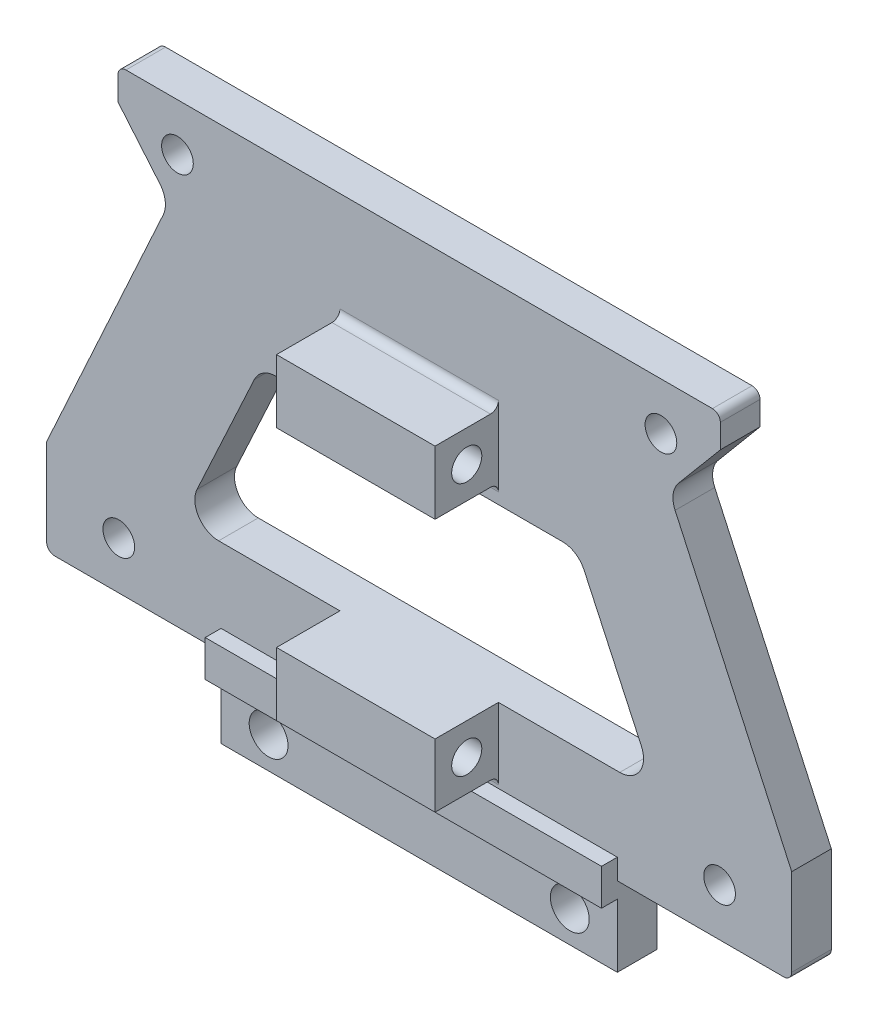
from build123d import *

# Parameters (mm, degrees)
SKETCH_1_R          = 2
EXTRUDE_2_DEPTH     = 5
SKETCH_3_W          = 20
SKETCH_3_H          = 8
EXTRUDE_3_DEPTH     = 8
SKETCH_4_R          = 1.9
CUT_EXTRUDE_1_DEPTH = 73.711050963
FILLET_1_R          = 3
FILLET_2_R          = 3
SKETCH_5_W          = 25
SKETCH_5_H          = 10
EXTRUDE_4_DEPTH     = 5
SKETCH_6_W          = 50
SKETCH_6_H          = 4.584747815
EXTRUDE_5_DEPTH     = 2
FILLET_3_R          = 1
FILLET_4_R          = 1
SKETCH_7_R          = 2.45
CUT_EXTRUDE_2_DEPTH = 4
FILLET_5_R          = 1
FILLET_6_R          = 1


with BuildPart() as part:
    # ｽｹｯﾁ1 → ﾎﾞｽ - 押し出し2 (new body)
    with BuildSketch(Plane.XY):
        Polygon((-47, -31.230740592), (-47, -43.230740592), (47, -43.230740592), (47, -31.230740592), (31.5, 2.619259408), (38, 10.369259408), (38, 14.369259408), (-38, 14.369259408), (-38, 10.369259408), (-31.5, 2.619259408), align=None)
        with Locations((-30.5, 8.369259408)):
            Circle(SKETCH_1_R, mode=Mode.SUBTRACT)
        with Locations((30.5, 8.369259408)):
            Circle(SKETCH_1_R, mode=Mode.SUBTRACT)
        with Locations((-37.9, -37.230740592)):
            Circle(SKETCH_1_R, mode=Mode.SUBTRACT)
        with Locations((37.9, -37.230740592)):
            Circle(SKETCH_1_R, mode=Mode.SUBTRACT)
        Polygon((-20, -9.630740592), (-30, -31.230740592), (30, -31.230740592), (20, -9.630740592), align=None, mode=Mode.SUBTRACT)
    extrude(amount=EXTRUDE_2_DEPTH)

    # ｽｹｯﾁ3 → ﾎﾞｽ - 押し出し3 (add)
    with BuildSketch(Plane.XY.offset(5)):
        with Locations((0, -3.230740592)):
            Rectangle(SKETCH_3_W, SKETCH_3_H)
        with Locations((0, -35.230740592)):
            Rectangle(SKETCH_3_W, SKETCH_3_H)
    extrude(amount=EXTRUDE_3_DEPTH)

    # ｽｹｯﾁ4 → ｶｯﾄ - 押し出し1 (cut, through all)
    with BuildSketch(Plane(origin=(10, 0, 0), x_dir=(0, 0, -1), z_dir=(1, 0, 0))):
        with Locations(Location((-9, -3.230740592, 0), (0, 0, 90))):
            Circle(SKETCH_4_R)
        with Locations(Location((-9, -35.230740592, 0), (0, 0, 90))):
            Circle(SKETCH_4_R)
    extrude(amount=-CUT_EXTRUDE_1_DEPTH, mode=Mode.SUBTRACT)

    # ﾌｨﾚｯﾄ1
    fillet_1_edges = [part.edges().sort_by_distance(p)[0] for p in [
        (-30, -31.230740592, 2.5),
        (30, -31.230740592, 2.5),
        (20, -9.630740592, 2.5),
        (-20, -9.630740592, 2.5),
    ]]
    fillet(fillet_1_edges, radius=FILLET_1_R)

    # ﾌｨﾚｯﾄ2
    fillet_2_edges = [part.edges().sort_by_distance(p)[0] for p in [
        (-31.5, 2.619259408, 2.5),
        (31.5, 2.619259408, 2.5),
    ]]
    fillet(fillet_2_edges, radius=FILLET_2_R)

    # ｽｹｯﾁ5 → ﾎﾞｽ - 押し出し4 (add)
    with BuildSketch(Plane.XY.offset(5)):
        with Locations((12.5, -48.230740592)):
            Rectangle(SKETCH_5_W, SKETCH_5_H)
        with Locations((-12.5, -48.230740592)):
            Rectangle(SKETCH_5_W, SKETCH_5_H)
    extrude(amount=-EXTRUDE_4_DEPTH)

    # ｽｹｯﾁ6 → ﾎﾞｽ - 押し出し5 (add)
    with BuildSketch(Plane.XY.offset(5)):
        with Locations((0, -42.938366685)):
            Rectangle(SKETCH_6_W, SKETCH_6_H)
    extrude(amount=EXTRUDE_5_DEPTH)

    # ﾌｨﾚｯﾄ3
    fillet_3_edges = [part.edges().sort_by_distance(p)[0] for p in [
        (-38, 14.369259408, 2.5),
        (38, 14.369259408, 2.5),
    ]]
    fillet(fillet_3_edges, radius=FILLET_3_R)

    # ﾌｨﾚｯﾄ4
    fillet_4_edges = [part.edges().sort_by_distance(p)[0] for p in [
        (47, -43.230740592, 2.5),
        (-47, -43.230740592, 2.5),
    ]]
    fillet(fillet_4_edges, radius=FILLET_4_R)

    # ｽｹｯﾁ7 → ｶｯﾄ - 押し出し2 (cut)
    with BuildSketch(Plane.XY.offset(5)):
        with Locations((-19, -49.230740592)):
            Circle(SKETCH_7_R)
        with Locations((19, -49.230740592)):
            Circle(SKETCH_7_R)
    extrude(amount=-CUT_EXTRUDE_2_DEPTH, mode=Mode.SUBTRACT)

    # ﾌｨﾚｯﾄ5
    fillet_5_edges = [part.edges().sort_by_distance(p)[0] for p in [
        (0, 0.769259408, 5),
        (0, -7.230740592, 5),
    ]]
    fillet(fillet_5_edges, radius=FILLET_5_R)

    # ﾌｨﾚｯﾄ6
    fillet_6_edges = [part.edges().sort_by_distance(p)[0] for p in [
        (0, -39.230740592, 5),
    ]]
    fillet(fillet_6_edges, radius=FILLET_6_R)


solid = part.part
